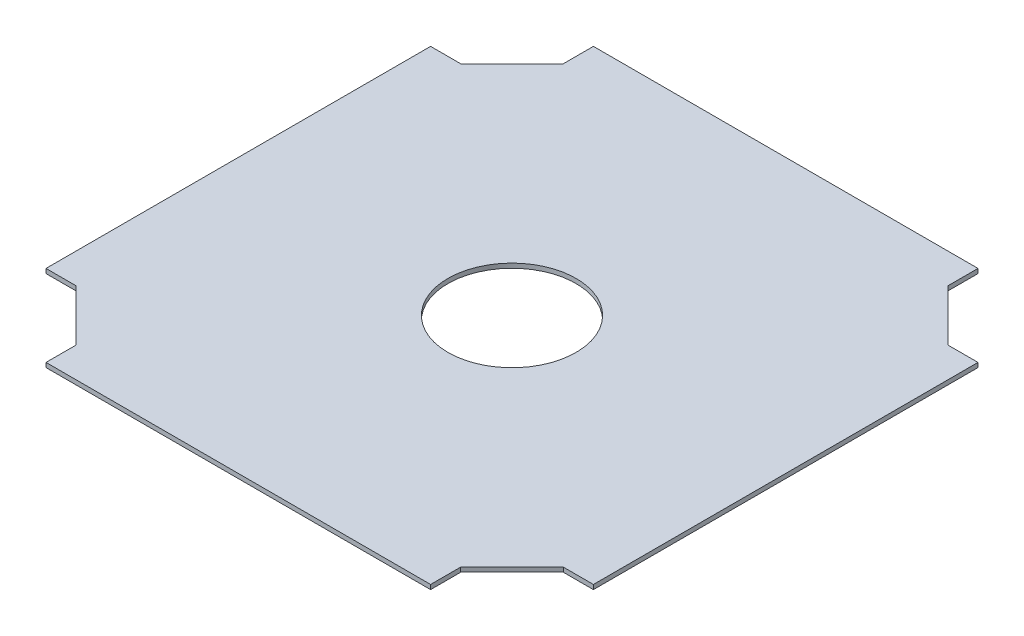
from build123d import *

# Parameters (mm, degrees)
BOSS_EXTRUDE1_DEPTH = 3.5
SKETCH2_R           = 50
CUT_EXTRUDE1_DEPTH  = 10


with BuildPart() as part:
    # Sketch1 → Boss-Extrude1 (new body)
    with BuildSketch(Plane(origin=(0, 0, 0), x_dir=(1, 0, 0), z_dir=(0, 1, 0))):
        Polygon((-363.5, 423.5), (-363.5, 403.5), (-403.5, 363.5), (-423.5, 363.5), (-427, 363.5), (-427, 63.5), (-423.5, 63.5), (-403.5, 63.5), (-363.5, 23.5), (-363.5, 3.5), (-363.5, 0), (-63.5, 0), (-63.5, 3.5), (-63.5, 23.5), (-23.5, 63.5), (-3.5, 63.5), (0, 63.5), (0, 363.5), (-3.5, 363.5), (-23.5, 363.5), (-63.5, 403.5), (-63.5, 423.5), (-63.5, 427), (-363.5, 427), align=None)
    extrude(amount=BOSS_EXTRUDE1_DEPTH)

    # Sketch2 → Cut-Extrude1 (cut)
    with BuildSketch(Plane(origin=(0, 3.5, 0), x_dir=(1, 0, 0), z_dir=(0, 1, 0))):
        with Locations(Location((-213.5, 213.5, 0), (0, 0, 270))):
            Circle(SKETCH2_R)
    extrude(amount=-CUT_EXTRUDE1_DEPTH, mode=Mode.SUBTRACT)


solid = part.part
